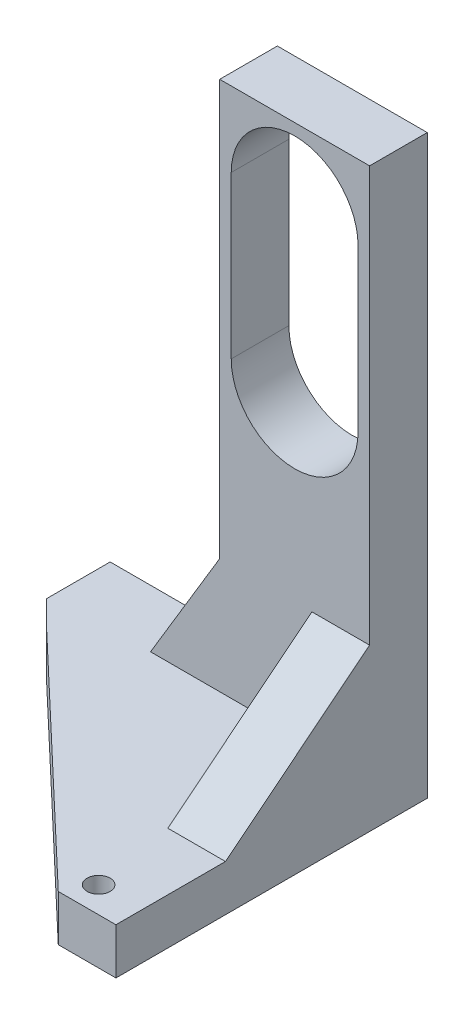
from build123d import *

# Parameters (mm, degrees)
SKETCH_2_W           = 26
SKETCH_2_H           = 97
EXTRUDE_1_DEPTH      = 10
CUT_EXTRUDE_11_DEPTH = 10
EXTRUDE_2_DEPTH      = 3
SKETCH_7_R           = 2
CUT_EXTRUDE_12_DEPTH = 120.519872825
EXTRUDE_6_DEPTH      = 5
EXTRUDE_8_DEPTH      = 10
CUT_EXTRUDE_START    = -10
SKETCH_14_R          = 2
CUT_EXTRUDE_13_DEPTH = 10
EXTRUDE_9_DEPTH      = 10
EXTRUDE_10_DEPTH     = 8


with BuildPart() as part:
    # 草图2 → 凸台-拉伸1 (new body)
    with BuildSketch(Plane.XY):
        with Locations((0, -10.25)):
            Rectangle(SKETCH_2_W, SKETCH_2_H)
    extrude(amount=EXTRUDE_1_DEPTH)

    # 草图3 → 切除-拉伸11 (cut)
    with BuildSketch(Plane.XY):
        with BuildLine():
            Line((-11, -2.75), (-11, 25.25))
            ThreePointArc((-11, 25.25), (0, 36.25), (11, 25.25))
            Line((11, 25.25), (11, -2.75))
            ThreePointArc((11, -2.75), (0, -13.75), (-11, -2.75))
        make_face()
    extrude(amount=CUT_EXTRUDE_11_DEPTH, mode=Mode.SUBTRACT)

    # 草图4 → 凸台-拉伸2 (add)
    with BuildSketch(Plane.XZ.offset(58.75)):
        Polygon((13, 0), (13, 54), (3, 54), (-37, 16), (-37, 0), align=None)
    extrude(amount=EXTRUDE_2_DEPTH)

    # 草图7 → 切除-拉伸12 (cut, through all)
    with BuildSketch(Plane.XZ.offset(61.75)):
        with Locations(Location((5.5, 49.5, 0), (0, 0, 270))):
            Circle(SKETCH_7_R)
    extrude(amount=-CUT_EXTRUDE_12_DEPTH, mode=Mode.SUBTRACT)

    # 草图9 → 凸台-拉伸6 (add)
    with BuildSketch(Plane(origin=(0, -58.75, 0), x_dir=(1, 0, 0), z_dir=(0, 1, 0))):
        Polygon((-37, 0), (-37, -16), (3, -54), (13, -54), (13, -10), (-13, -10), (-13, 0), align=None)
    extrude(amount=EXTRUDE_6_DEPTH)

    # 草图12 → 凸台-拉伸8 (add)
    with BuildSketch(Plane(origin=(13, 0, 0), x_dir=(0, 0, -1), z_dir=(1, 0, 0))):
        Polygon((-10, -53.75), (-35, -53.75), (-10, -33.75), align=None)
    extrude(amount=-EXTRUDE_8_DEPTH)

    # 草图14 → 切除-拉伸13 (cut)
    with BuildSketch(Plane(origin=(0, -53.75, 0), x_dir=(1, 0, 0), z_dir=(0, 1, 0)).offset(CUT_EXTRUDE_START)):
        with Locations(Location((5.5, -49.5, 0), (0, 0, 90))):
            Circle(SKETCH_14_R)
    extrude(amount=CUT_EXTRUDE_13_DEPTH, mode=Mode.SUBTRACT)

    # 草图11 → 凸台-拉伸9 (add)
    with BuildSketch(Plane.XY.offset(10)):
        Polygon((-13, -53.75), (-25, -53.75), (-13, -33.75), align=None)
    extrude(amount=-EXTRUDE_9_DEPTH)

    # 草图15 → 凸台-拉伸10 (add)
    with BuildSketch(Plane(origin=(0, -53.75, 0), x_dir=(1, 0, 0), z_dir=(0, 1, 0))):
        Polygon((-37, 0), (-42, 0), (-42, -11), (-37, -16), align=None)
    extrude(amount=-EXTRUDE_10_DEPTH)


solid = part.part
